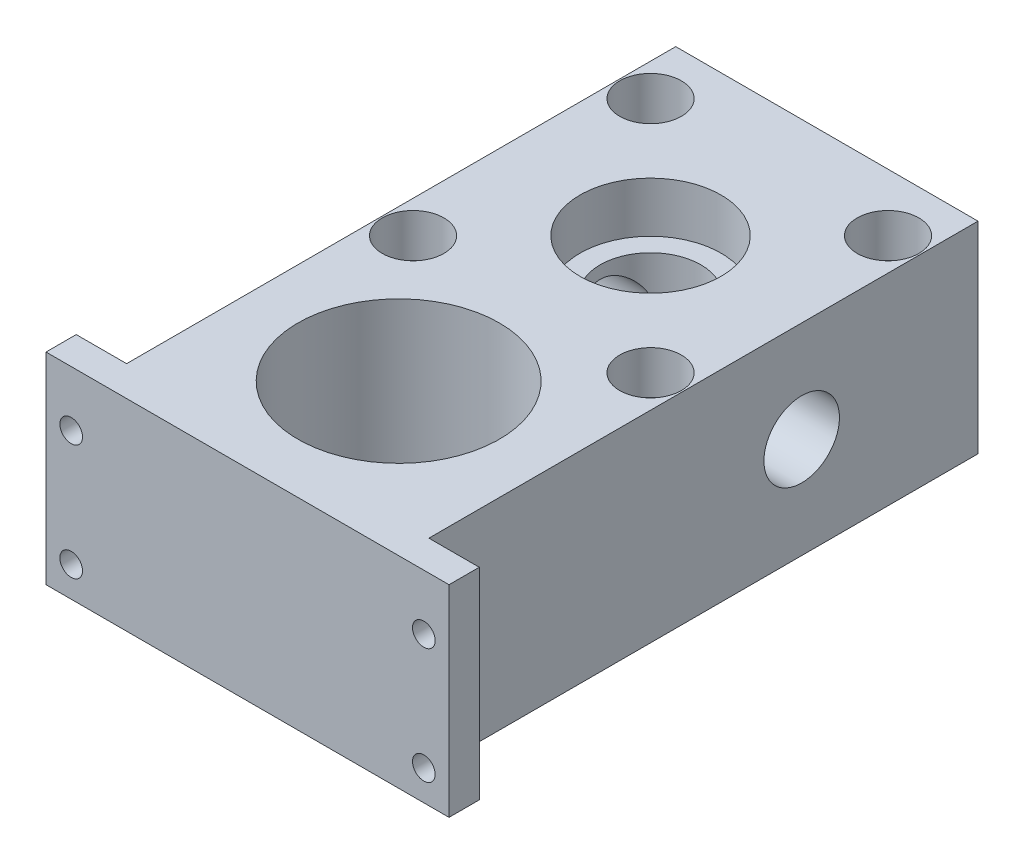
from build123d import *

# Parameters (mm, degrees)
SKETCH1_R                                       = 10
BOSS_EXTRUDE1_DEPTH                             = 40
SKETCH2_R                                       = 14
CUT_EXTRUDE1_DEPTH                              = 12
CUT_EXTRUDE2_START                              = -10
SKETCH3_R                                       = 14
CUT_EXTRUDE2_DEPTH                              = 10
SKETCH5_R                                       = 19.05
CUT_EXTRUDE3_DEPTH                              = 2
CBORE_FOR_M5_HEX_HEAD_BOLT1_D                   = 5.5
CBORE_FOR_M5_HEX_HEAD_BOLT1_CBORE_D             = 12.24
CBORE_FOR_M5_HEX_HEAD_BOLT1_CBORE_DEPTH         = 8.58
CSK_FOR_M4_FLAT_HEAD_MACHINE_SCREW1_D           = 4.5
CSK_FOR_M4_FLAT_HEAD_MACHINE_SCREW1_CSINK_D     = 9.4
CSK_FOR_M4_FLAT_HEAD_MACHINE_SCREW1_CSINK_ANGLE = 90
LPATTERN1_COUNT                                 = 2
LPATTERN1_PITCH                                 = 23
LPATTERN1_COUNT_DIR2                            = 2
LPATTERN1_PITCH_DIR2                            = 70
SKETCH13_R                                      = 7.5
CUT_EXTRUDE4_DEPTH                              = 136.576546644
SKETCH14_R                                      = 20.000672508
CUT_EXTRUDE5_DEPTH                              = 136.576546644


with BuildPart() as part:
    # Sketch1 → Boss-Extrude1 (new body)
    with BuildSketch(Plane(origin=(0, 0, 0), x_dir=(1, 0, 0), z_dir=(0, 1, 0))):
        Polygon((0, 0), (-10, 0), (-10, -6), (70, -6), (70, 0), (60, 0), (60, 109), (0, 109), align=None)
        with Locations(Location((30, 74, 0), (0, 0, 270))):
            Circle(SKETCH1_R, mode=Mode.SUBTRACT)
    extrude(amount=BOSS_EXTRUDE1_DEPTH)

    # Sketch2 → Cut-Extrude1 (cut)
    with BuildSketch(Plane.XZ):
        with Locations(Location((30, -74, 0), (0, 0, 270))):
            Circle(SKETCH2_R)
    extrude(amount=-CUT_EXTRUDE1_DEPTH, mode=Mode.SUBTRACT)

    # Sketch3 → Cut-Extrude2 (cut)
    with BuildSketch(Plane(origin=(0, 40, 0), x_dir=(1, 0, 0), z_dir=(0, 1, 0)).offset(CUT_EXTRUDE2_START)):
        with Locations(Location((30, 74, 0), (0, 0, 90))):
            Circle(SKETCH3_R)
    extrude(amount=CUT_EXTRUDE2_DEPTH, mode=Mode.SUBTRACT)

    # Sketch5 → Cut-Extrude3 (cut)
    with BuildSketch(Plane.XZ):
        with Locations(Location((30, -74, 0), (0, 0, 270))):
            Circle(SKETCH5_R)
    extrude(amount=-CUT_EXTRUDE3_DEPTH, mode=Mode.SUBTRACT)

    # CBORE for M5 Hex Head Bolt1 (through all)
    with Locations(Plane(origin=(0, 40, 0), x_dir=(-1, 0, 0), z_dir=(0, 1, 0))):
        with Locations((-6.43, -97.57), (-6.43, -50.43), (-53.57, -50.43), (-53.57, -97.57)):
            CounterBoreHole(CBORE_FOR_M5_HEX_HEAD_BOLT1_D / 2, CBORE_FOR_M5_HEX_HEAD_BOLT1_CBORE_D / 2, CBORE_FOR_M5_HEX_HEAD_BOLT1_CBORE_DEPTH)

    # CSK for M4 Flat Head Machine Screw1 (through all)
    with Locations(Plane(origin=(0, 0, 0), x_dir=(-1, 0, 0), z_dir=(0, 0, -1))):
        with Locations((-65, 6)):
            csk_for_m4_flat_head_machine_screw1 = CounterSinkHole(CSK_FOR_M4_FLAT_HEAD_MACHINE_SCREW1_D / 2, CSK_FOR_M4_FLAT_HEAD_MACHINE_SCREW1_CSINK_D / 2, counter_sink_angle=CSK_FOR_M4_FLAT_HEAD_MACHINE_SCREW1_CSINK_ANGLE)

    # LPattern1: CSK for M4 Flat Head Machine Screw1 2 × 2
    with Locations(*[(-j * LPATTERN1_PITCH_DIR2, i * LPATTERN1_PITCH, 0) for i in range(LPATTERN1_COUNT) for j in range(LPATTERN1_COUNT_DIR2) if (i, j) != (0, 0)]):
        add(csk_for_m4_flat_head_machine_screw1, mode=Mode.SUBTRACT)

    # Sketch13 → Cut-Extrude4 (cut, through all)
    with BuildSketch(Plane(origin=(60, 0, 0), x_dir=(0, 0, -1), z_dir=(1, 0, 0))):
        with Locations((74, 20)):
            Circle(SKETCH13_R)
    extrude(amount=-CUT_EXTRUDE4_DEPTH, mode=Mode.SUBTRACT)

    # Sketch14 → Cut-Extrude5 (cut, through all)
    with BuildSketch(Plane.XZ):
        with Locations(Location((30, -24, 0), (0, 0, 270))):
            Circle(SKETCH14_R)
    extrude(amount=-CUT_EXTRUDE5_DEPTH, mode=Mode.SUBTRACT)


solid = part.part
